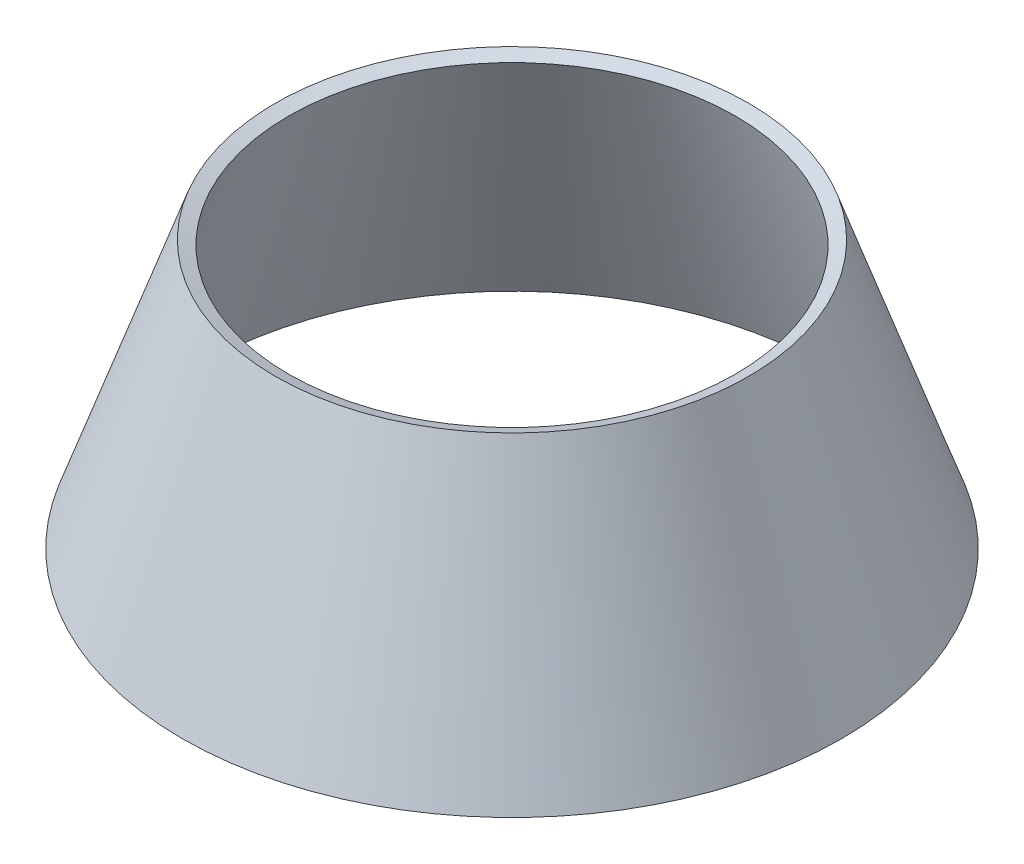
from build123d import *

# Parameters (mm, degrees)
ENL_V_MAT_EXTRU_1_DEPTH      = 98.355161896
ENL_V_MAT_EXTRU_1_DEPTH_BACK = 98.355161896
ESQUISSE3_W                  = 47.360210786
ESQUISSE3_H                  = 0.328866647


with BuildPart() as part:
    # Esquisse2 → Base-Révol.-Mince (revolve)
    with BuildSketch(Plane(origin=(0, 0, 0), x_dir=(0, 0, -1), z_dir=(1, 0, 0))):
        Polygon((-24.503826694, -48.806361526), (-17.819894607, -68), (-18.764270977, -68.328866647), (-25.448203064, -49.135228172), align=None)
    revolve(axis=Axis((0, -110, 41.5), (0, 1, 0)))

    # Esquisse3 → Enlèv. mat.-Extru.1 (cut, two sides: drawn at the far end of the back side and taken through both)
    with BuildSketch(Plane(origin=(0, 0, 0), x_dir=(0, 0, -1), z_dir=(1, 0, 0)).offset(-ENL_V_MAT_EXTRU_1_DEPTH_BACK)):
        with Locations((-41.5, -68.164433323)):
            Rectangle(ESQUISSE3_W, ESQUISSE3_H)
    extrude(amount=ENL_V_MAT_EXTRU_1_DEPTH + ENL_V_MAT_EXTRU_1_DEPTH_BACK, mode=Mode.SUBTRACT)


solid = part.part
